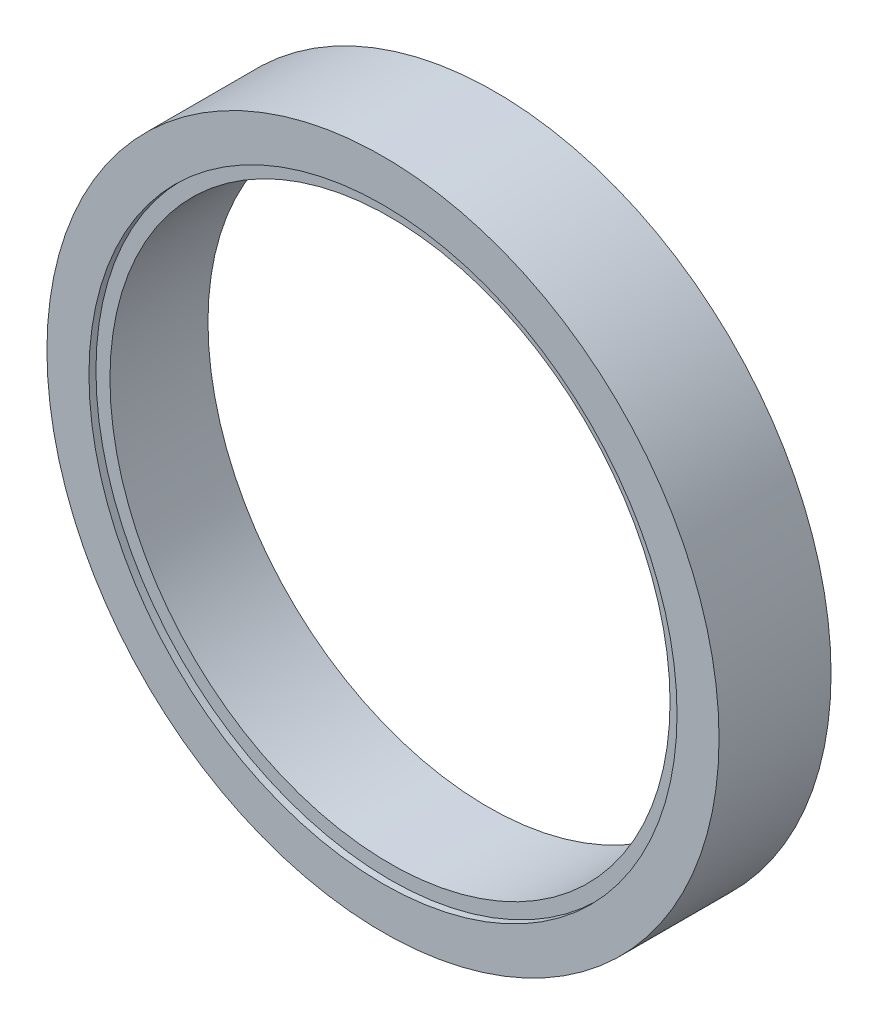
from build123d import *

# Parameters (mm, degrees)
SKETCH1_R           = 76.2
SKETCH1_R_2         = 63.5
BOSS_EXTRUDE1_DEPTH = 12.7
SKETCH2_R           = 66.675
CUT_EXTRUDE1_DEPTH  = 1.5875
SKETCH3_R           = 69.85
CUT_EXTRUDE2_DEPTH  = 1.5875


with BuildPart() as part:
    # Sketch1 → Boss-Extrude1 (new, symmetric)
    with BuildSketch(Plane.XY):
        Circle(SKETCH1_R)
        Circle(SKETCH1_R_2, mode=Mode.SUBTRACT)
    extrude(amount=BOSS_EXTRUDE1_DEPTH, both=True)

    # Sketch2 → Cut-Extrude1 (cut)
    with BuildSketch(Plane.XY.offset(12.7)):
        Circle(SKETCH2_R)
    extrude(amount=-CUT_EXTRUDE1_DEPTH, mode=Mode.SUBTRACT)

    # Sketch3 → Cut-Extrude2 (cut)
    with BuildSketch(Plane(origin=(0, 0, -12.7), x_dir=(-1, 0, 0), z_dir=(0, 0, -1))):
        Circle(SKETCH3_R)
    extrude(amount=-CUT_EXTRUDE2_DEPTH, mode=Mode.SUBTRACT)


solid = part.part
